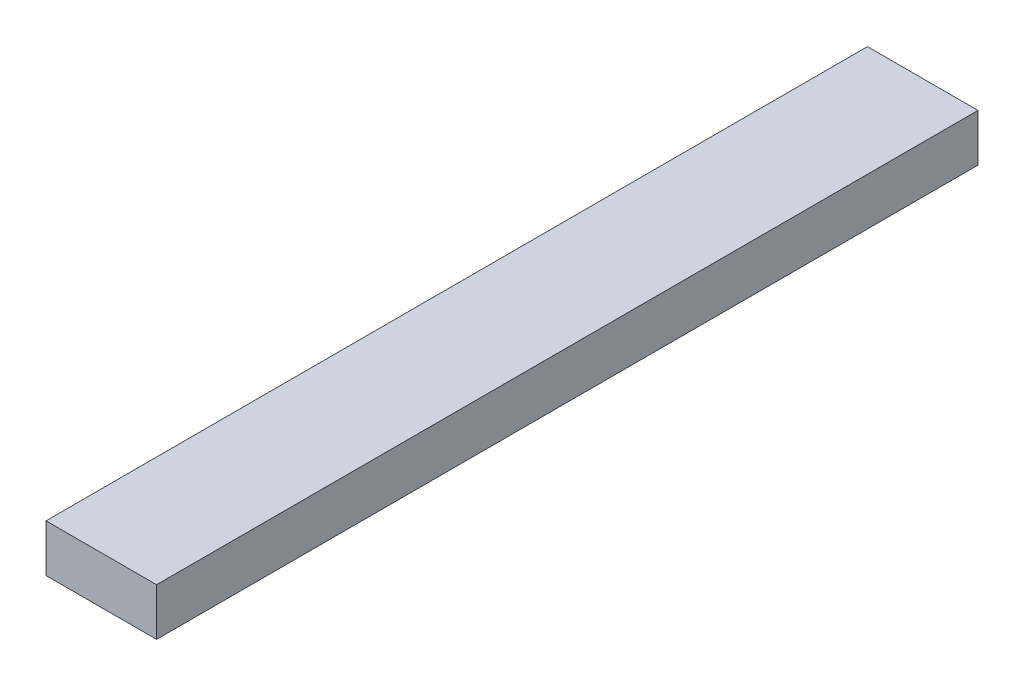
from build123d import *

# Parameters (mm, degrees)
SKETCH1_W           = 88.9
SKETCH1_H           = 38.1
BOSS_EXTRUDE1_DEPTH = 660.4


with BuildPart() as part:
    # Sketch1 → Boss-Extrude1 (new body)
    with BuildSketch(Plane.XY):
        with Locations((44.45, 19.05)):
            Rectangle(SKETCH1_W, SKETCH1_H)
    extrude(amount=BOSS_EXTRUDE1_DEPTH)


solid = part.part
